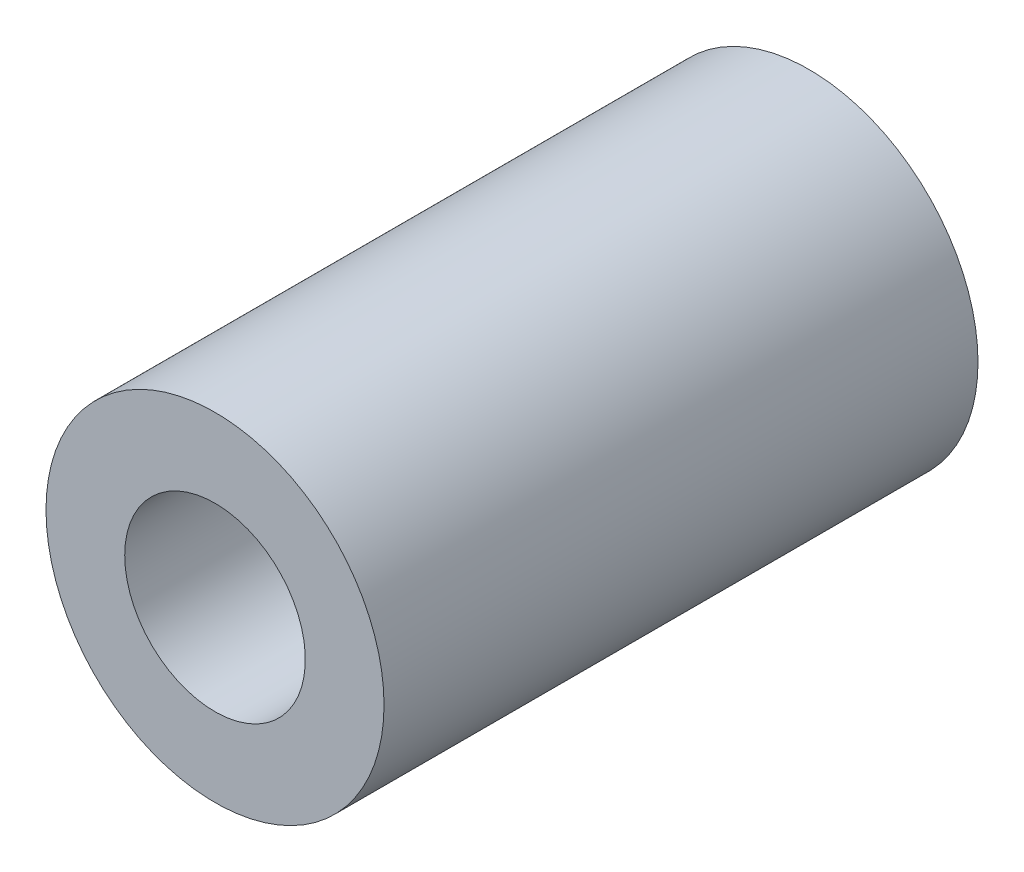
from build123d import *

# Parameters (mm, degrees)
SKETCH1_R           = 8.89
SKETCH1_R_2         = 4.750000017
BOSS_EXTRUDE1_DEPTH = 31.242


with BuildPart() as part:
    # Sketch1 → Boss-Extrude1 (new body)
    with BuildSketch(Plane.XY):
        with Locations(Location((0, 0, 0), (0, 0, 180))):
            Circle(SKETCH1_R)
        with Locations(Location((0, 0, 0), (0, 0, 180))):
            Circle(SKETCH1_R_2, mode=Mode.SUBTRACT)
    extrude(amount=BOSS_EXTRUDE1_DEPTH)


solid = part.part
